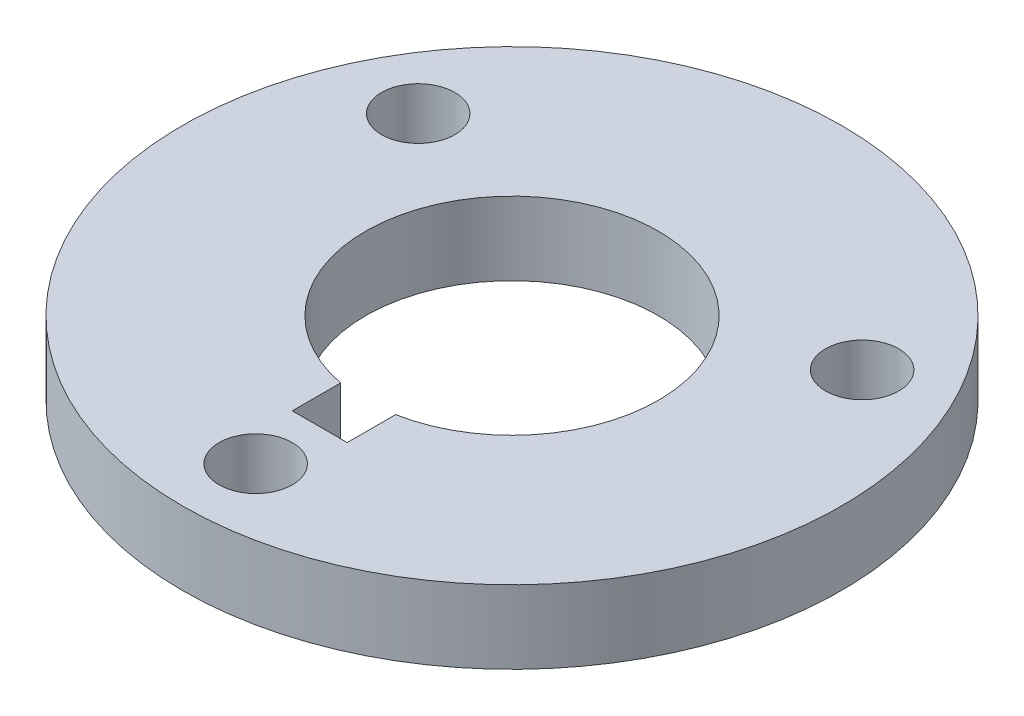
from build123d import *

# Parameters (mm, degrees)
SKETCH1_R           = 14.2875
BOSS_EXTRUDE2_DEPTH = 3.175


with BuildPart() as part:
    # Sketch1 → Boss-Extrude2 (new body)
    # profile 1 of 5: a face of its own
    with BuildSketch(Plane(origin=(0, 0, 0), x_dir=(1, 0, 0), z_dir=(0, 1, 0))):
        with Locations(Location((0, 0, 0), (0, 0, 270))):
            Circle(SKETCH1_R)
        with BuildLine():
            Line((-1.190625, 6.237380228), (-1.190625, 8.334375))
            Line((-1.190625, 8.334375), (1.190625, 8.334375))
            Line((1.190625, 8.334375), (1.190625, 6.237380228))
            ThreePointArc((1.190625, 6.237380228), (2.159427274, 5.971547023), (3.074180531, 5.55625))
            Line((3.074180531, 5.55625), (8.0362073, 5.55625))
            ThreePointArc((8.0362073, 5.55625), (9.6237073, 7.14375), (11.2112073, 5.55625))
            ThreePointArc((11.2112073, 5.55625), (10.4174573, 4.181434671), (8.8299573, 4.181434671))
            Line((8.8299573, 4.181434671), (6.348943915, -0.115806564))
            ThreePointArc((6.348943915, -0.115806564), (5.499261314, -3.175), (3.274763384, -5.440443436))
            Line((3.274763384, -5.440443436), (0.79375, -9.737684671))
            ThreePointArc((0.79375, -9.737684671), (1.374815329, -10.31875), (1.5875, -11.1125))
            ThreePointArc((1.5875, -11.1125), (-0.79375, -12.487315329), (-0.79375, -9.737684671))
            Line((-0.79375, -9.737684671), (-3.274763384, -5.440443436))
            ThreePointArc((-3.274763384, -5.440443436), (-5.499261314, -3.175), (-6.348943915, -0.115806564))
            Line((-6.348943915, -0.115806564), (-8.8299573, 4.181434671))
            ThreePointArc((-8.8299573, 4.181434671), (-10.998522628, 6.35), (-8.0362073, 5.55625))
            Line((-8.0362073, 5.55625), (-3.074180531, 5.55625))
            ThreePointArc((-3.074180531, 5.55625), (-2.159427274, 5.971547023), (-1.190625, 6.237380228))
        make_face(mode=Mode.SUBTRACT)
    # profile 2 of 5: a face of its own
    with BuildSketch(Plane(origin=(0, 0, 0), x_dir=(1, 0, 0), z_dir=(0, 1, 0))):
        with BuildLine():
            ThreePointArc((-6.348943915, -0.115806564), (-5.499261314, 3.175), (-3.074180531, 5.55625))
            Line((-3.074180531, 5.55625), (-8.0362073, 5.55625))
            ThreePointArc((-8.0362073, 5.55625), (-8.248891971, 4.7625), (-8.8299573, 4.181434671))
            Line((-8.8299573, 4.181434671), (-6.348943915, -0.115806564))
        make_face()
    # profile 3 of 5: a face of its own
    with BuildSketch(Plane(origin=(0, 0, 0), x_dir=(1, 0, 0), z_dir=(0, 1, 0))):
        with BuildLine():
            Line((8.0362073, 5.55625), (3.074180531, 5.55625))
            ThreePointArc((3.074180531, 5.55625), (5.470079815, 3.225015785), (6.35, 0))
            ThreePointArc((6.35, 0), (6.349735973, -0.05790569), (6.348943915, -0.115806564))
            Line((6.348943915, -0.115806564), (8.8299573, 4.181434671))
            ThreePointArc((8.8299573, 4.181434671), (8.248891971, 4.7625), (8.0362073, 5.55625))
        make_face()
    # profile 4 of 5: a face of its own
    with BuildSketch(Plane(origin=(0, 0, 0), x_dir=(1, 0, 0), z_dir=(0, 1, 0))):
        with BuildLine():
            Line((-1.190625, -8.334375), (-1.190625, -6.237380228))
            ThreePointArc((-1.190625, -6.237380228), (-2.267972755, -5.931171856), (-3.274763384, -5.440443436))
            Line((-3.274763384, -5.440443436), (-0.79375, -9.737684671))
            ThreePointArc((-0.79375, -9.737684671), (0, -9.525), (0.79375, -9.737684671))
            Line((0.79375, -9.737684671), (3.274763384, -5.440443436))
            ThreePointArc((3.274763384, -5.440443436), (2.267972755, -5.931171856), (1.190625, -6.237380228))
            Line((1.190625, -6.237380228), (1.190625, -8.334375))
            Line((1.190625, -8.334375), (-1.190625, -8.334375))
        make_face()
    # profile 5 of 5: a face of its own
    with BuildSketch(Plane(origin=(0, 0, 0), x_dir=(1, 0, 0), z_dir=(0, 1, 0))):
        with BuildLine():
            Line((1.190625, 8.334375), (-1.190625, 8.334375))
            Line((-1.190625, 8.334375), (-1.190625, 6.237380228))
            ThreePointArc((-1.190625, 6.237380228), (0, 6.35), (1.190625, 6.237380228))
            Line((1.190625, 6.237380228), (1.190625, 8.334375))
        make_face()
    extrude(amount=BOSS_EXTRUDE2_DEPTH)


solid = part.part
